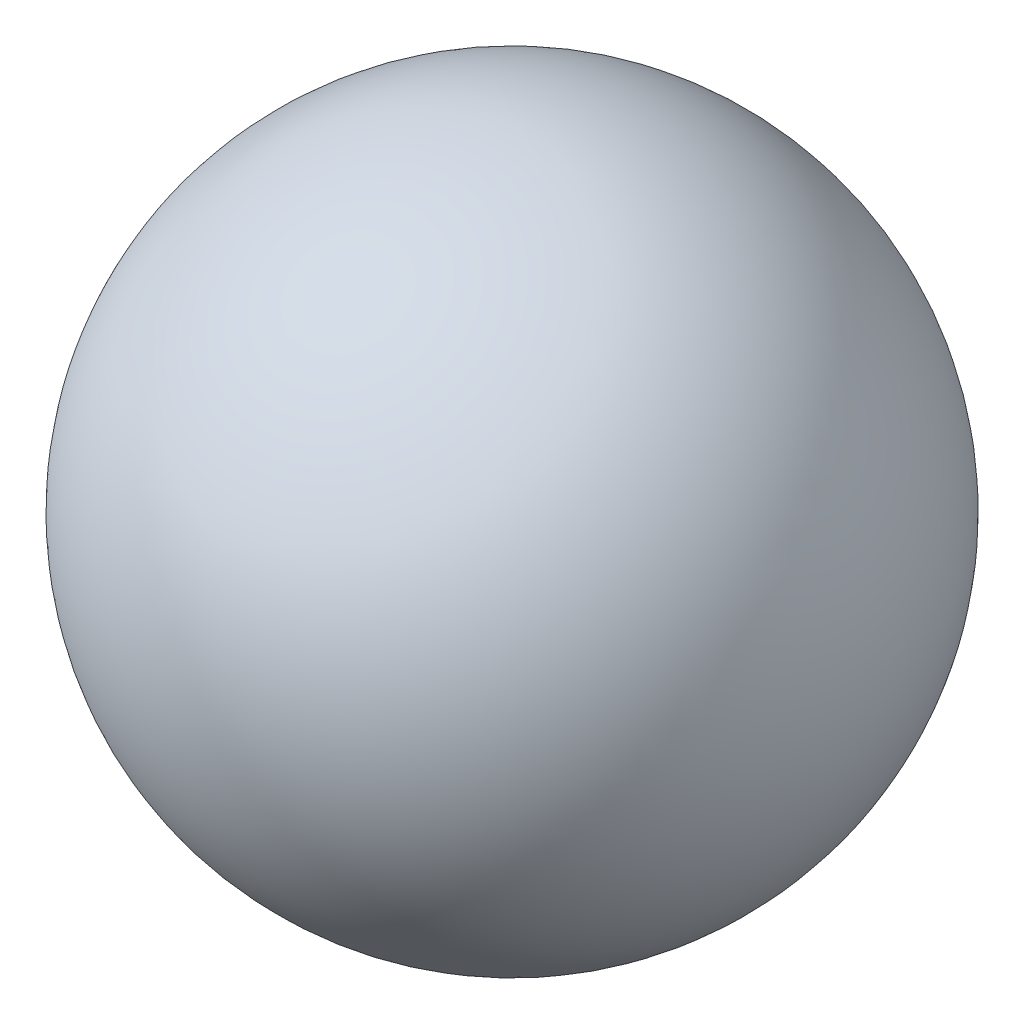
from build123d import *


with BuildPart() as part:
    # 草图1 → 旋转6 (revolve)
    with BuildSketch(Plane.XY):
        with BuildLine():
            Line((16, 0), (-16, 0))
            ThreePointArc((-16, 0), (0, 16), (16, 0))
        make_face()
    revolve(axis=Axis((16, 0, 0), (-1, 0, 0)))


solid = part.part
